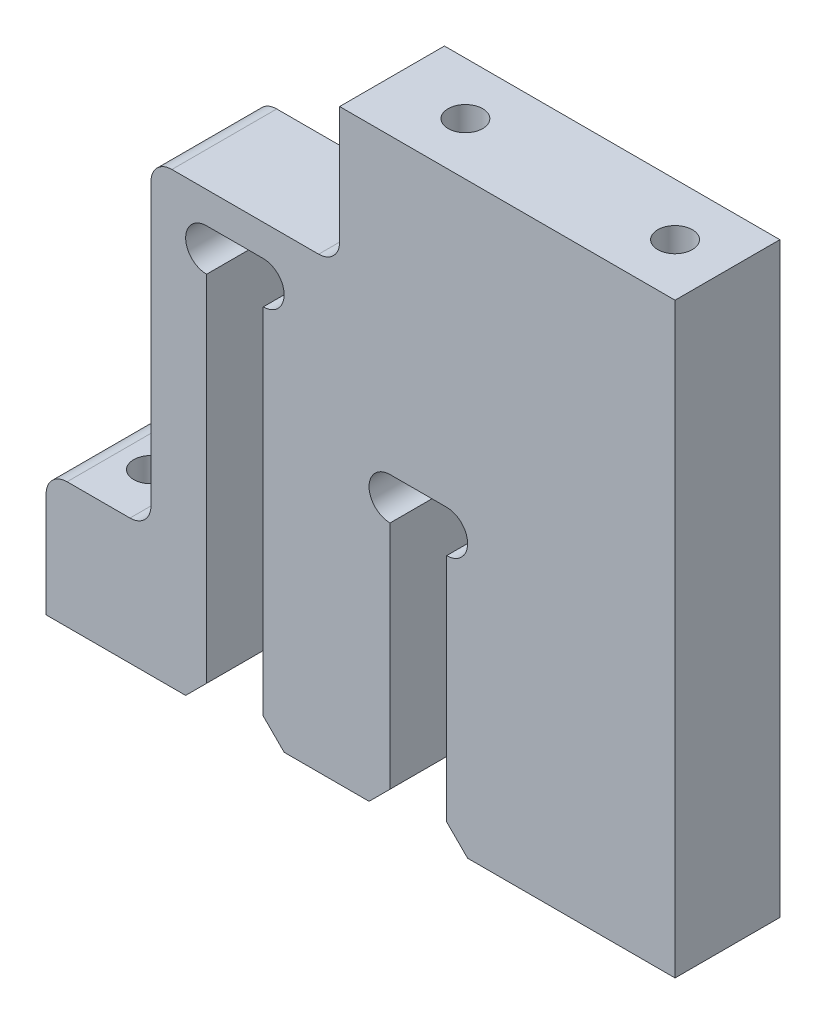
from build123d import *

# Parameters (mm, degrees)
SKETCH_1_W             = 60
SKETCH_1_H             = 56
EXTRUDE_1_DEPTH        = 5
SKETCH_3_W             = 5.4
SKETCH_3_H             = 28
SKETCH_3_H_2           = 39.8
CUT_EXTRUDE_1_DEPTH    = 43.237424164
HOLE_WIZARD_M4_1_D     = 3.3
HOLE_WIZARD_M4_1_DEPTH = 12.1
HOLE_WIZARD_M4_1_TIP   = 0.991420021
MM_1_D                 = 4
MM_1_DEPTH             = 13
MM_1_TIP               = 1.201721238
CHAMFER_1_SIZE         = 2
CUT_EXTRUDE_4_DEPTH    = 43.237424164
FILLET_2_R             = 2
HOLE_WIZARD_M4_2_D     = 3.3
HOLE_WIZARD_M4_2_DEPTH = 12.1
HOLE_WIZARD_M4_2_TIP   = 0.991420021


with BuildPart() as part:
    # 草图1 → 凸台-拉伸1 (new, symmetric)
    with BuildSketch(Plane.XY):
        Rectangle(SKETCH_1_W, SKETCH_1_H)
    extrude(amount=EXTRUDE_1_DEPTH, both=True)

    # 草图3 → 切除-拉伸1 (cut, through all)
    with BuildSketch(Plane.XY.offset(5)):
        with Locations((5.51, -14)):
            Rectangle(SKETCH_3_W, SKETCH_3_H)
        with Locations((-11.99, -8.1)):
            Rectangle(SKETCH_3_W, SKETCH_3_H_2)
    extrude(amount=-CUT_EXTRUDE_1_DEPTH, mode=Mode.SUBTRACT)

    # M4 螺纹孔1
    with Locations(Plane(origin=(0, -28, 0), x_dir=(-1, 0, 0), z_dir=(0, -1, 0))):
        with Locations((25, 0), (-25, 0)):
            Hole(HOLE_WIZARD_M4_1_D / 2, depth=HOLE_WIZARD_M4_1_DEPTH)
            with Locations((0, 0, -(HOLE_WIZARD_M4_1_DEPTH + HOLE_WIZARD_M4_1_TIP / 2))):  # 118° drill point
                Cone(0, HOLE_WIZARD_M4_1_D / 2, HOLE_WIZARD_M4_1_TIP, mode=Mode.SUBTRACT)

    # 大小mm 暗销孔1
    with Locations(Plane.XY.offset(5)):
        with Locations((-14.69, 9.8), (-9.29, 9.8), (2.81, -2), (8.21, -2)):
            Hole(MM_1_D / 2, depth=MM_1_DEPTH)
            with Locations((0, 0, -(MM_1_DEPTH + MM_1_TIP / 2))):  # 118° drill point
                Cone(0, MM_1_D / 2, MM_1_TIP, mode=Mode.SUBTRACT)

    # 倒角1
    chamfer_1_edges = [part.edges().sort_by_distance(p)[0] for p in [
        (2.81, -28, 0),
        (8.21, -28, 0),
        (-9.29, -28, 0),
        (-14.69, -28, 0),
    ]]
    chamfer(chamfer_1_edges, length=CHAMFER_1_SIZE)

    # 草图13 → 切除-拉伸4 (cut, through all)
    with BuildSketch(Plane.XY.offset(5)):
        Polygon((-30, 28), (-2, 28), (-2, 14.8), (-20, 14.8), (-20, -16), (-30, -16), align=None)
    extrude(amount=-CUT_EXTRUDE_4_DEPTH, mode=Mode.SUBTRACT)

    # 圆角2
    fillet_2_edges = [part.edges().sort_by_distance(p)[0] for p in [
        (-20, -16, 0),
        (-30, -16, 0),
        (-2, 14.8, 0),
        (-20, 14.8, 0),
    ]]
    fillet(fillet_2_edges, radius=FILLET_2_R)

    # M4 螺纹孔2
    with Locations(Plane(origin=(0, 28, 0), x_dir=(1, 0, 0), z_dir=(0, 1, 0))):
        with Locations((25, 0), (5, 0)):
            Hole(HOLE_WIZARD_M4_2_D / 2, depth=HOLE_WIZARD_M4_2_DEPTH)
            with Locations((0, 0, -(HOLE_WIZARD_M4_2_DEPTH + HOLE_WIZARD_M4_2_TIP / 2))):  # 118° drill point
                Cone(0, HOLE_WIZARD_M4_2_D / 2, HOLE_WIZARD_M4_2_TIP, mode=Mode.SUBTRACT)


solid = part.part
